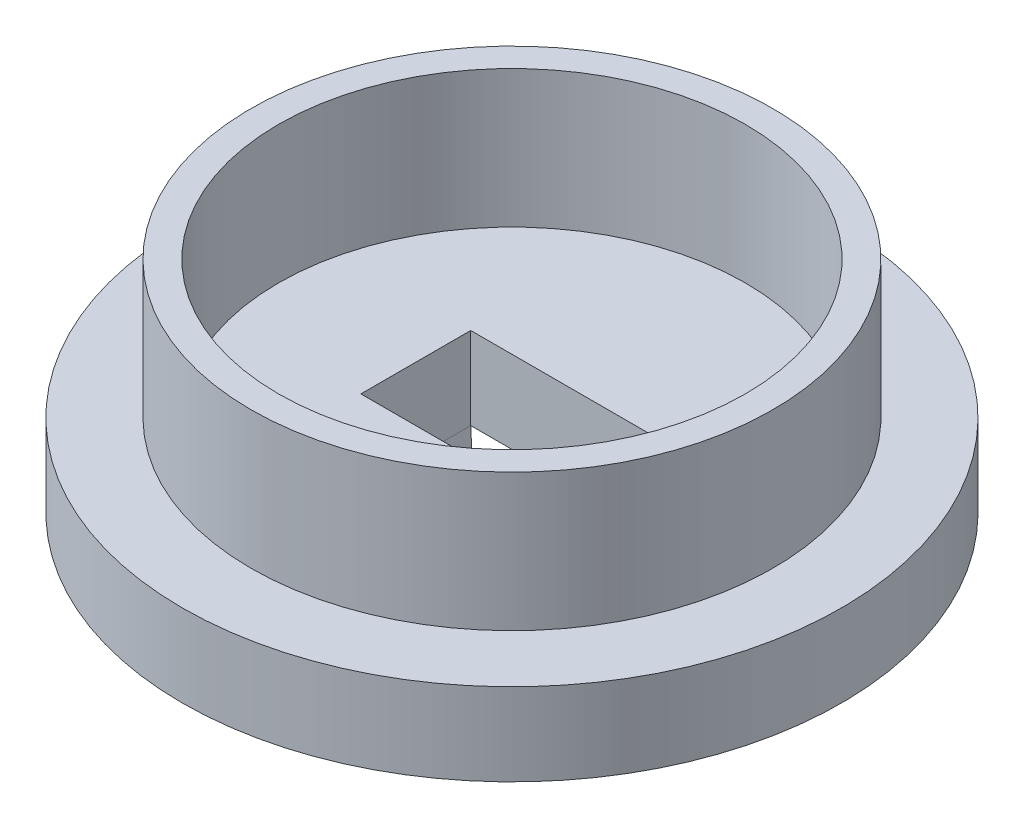
from build123d import *

# Parameters (mm, degrees)
PROFILES_R                  = 12
PROFILE_DEPTH               = 3
CONNECTINGWALLS_R           = 9.5
CONNECTINGWALLS_R_2         = 8.5
CONNECTINGWALL_DEPTH        = 5
CONNECTORCUTS_W             = 7
CONNECTORCUTS_H             = 4
CONNECTORCUT_DEPTH          = 19.761663039
CONNECTOR_REACH             = 20.762
CONNECTOR_DIRECTION_2_REACH = 20.762


with BuildPart() as part:
    # ProfileS → Profile (new body)
    with BuildSketch(Plane(origin=(0, 0, 0), x_dir=(1, 0, 0), z_dir=(0, 1, 0))):
        Circle(PROFILES_R)
    extrude(amount=PROFILE_DEPTH)

    # ConnectingWallS → ConnectingWall (add)
    with BuildSketch(Plane(origin=(0, 3, 0), x_dir=(1, 0, 0), z_dir=(0, 1, 0))):
        Circle(CONNECTINGWALLS_R)
        Circle(CONNECTINGWALLS_R_2, mode=Mode.SUBTRACT)
    extrude(amount=CONNECTINGWALL_DEPTH)

    # ConnectorCutS → ConnectorCut (cut, through all)
    with BuildSketch(Plane.XZ):
        Rectangle(CONNECTORCUTS_W, CONNECTORCUTS_H)
    extrude(amount=-CONNECTORCUT_DEPTH, mode=Mode.SUBTRACT)

    # Connector: up to this face of the body (flat: up to its plane)
    connector_end = Plane(part.part.faces().sort_by_distance((0, 1.5, 2))[0])
    # ConnectorS → Connector (add, up to the picked face)
    with BuildSketch(Plane.XY, mode=Mode.PRIVATE) as connector_sk1:
        Polygon((-3.5, 0), (-3.35, -3), (3.35, -3), (3.5, 0), (4.9, 0), (4.65, -5), (-4.65, -5), (-4.9, 0), align=None)
    connector_tool1 = split(extrude(connector_sk1.sketch, amount=CONNECTOR_REACH, mode=Mode.PRIVATE), bisect_by=connector_end, keep=Keep.BOTH, mode=Mode.PRIVATE)
    add(connector_tool1.solids().sort_by(Axis((0, -3.22549, 0), (0, 0, 1)))[0])

    # Connector direction 2: up to this face of the body (flat: up to its plane)
    connector_direction_2_end = Plane(part.part.faces().sort_by_distance((0, 1.5, -2))[0])
    # ConnectorS → Connector direction 2 (add, up to the picked face)
    with BuildSketch(Plane.XY, mode=Mode.PRIVATE) as connector_direction_2_sk1:
        Polygon((-3.5, 0), (-3.35, -3), (3.35, -3), (3.5, 0), (4.9, 0), (4.65, -5), (-4.65, -5), (-4.9, 0), align=None)
    connector_direction_2_tool1 = split(extrude(connector_direction_2_sk1.sketch, amount=-CONNECTOR_DIRECTION_2_REACH, mode=Mode.PRIVATE), bisect_by=connector_direction_2_end, keep=Keep.BOTH, mode=Mode.PRIVATE)
    add(connector_direction_2_tool1.solids().sort_by(Axis((0, -3.22549, 0), (0, 0, -1)))[0])


solid = part.part
